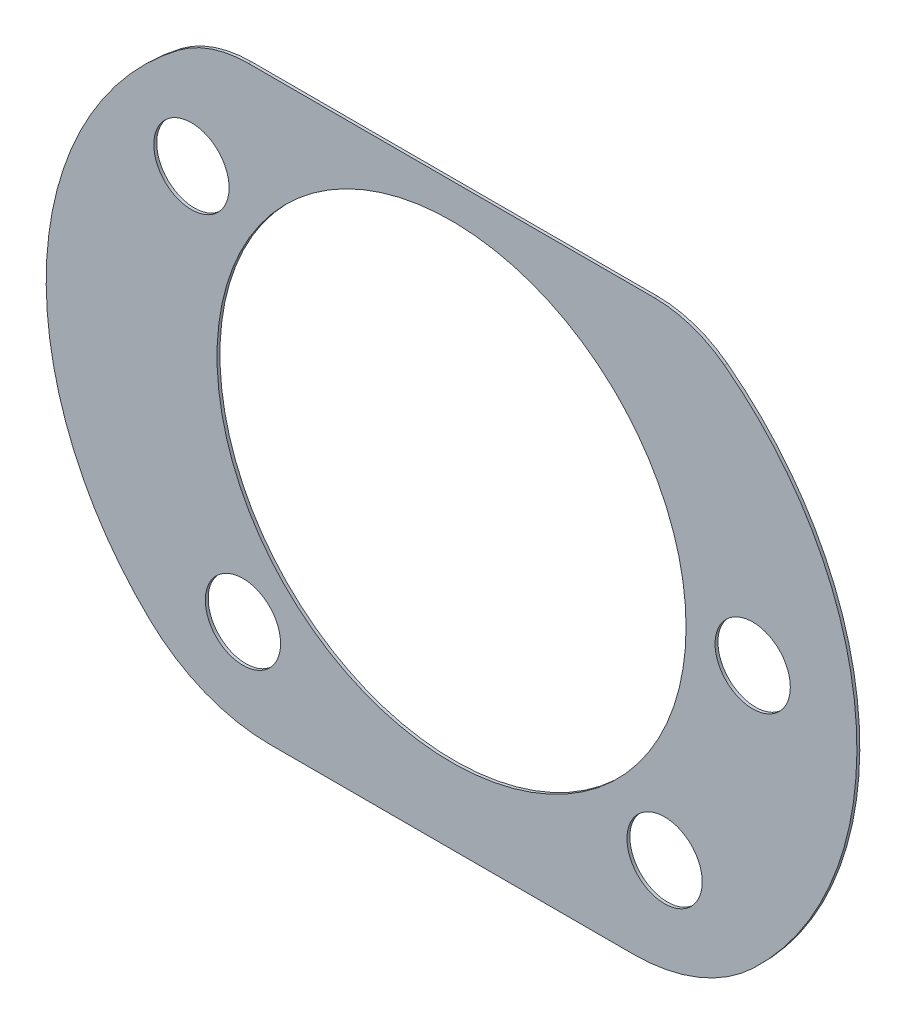
from build123d import *

# Parameters (mm, degrees)
SKETCH1_R      = 40.5
SKETCH1_R_2    = 6.5
EXTRUDE1_DEPTH = 0.5


with BuildPart() as part:
    # Sketch1 → Extrude1 (new body)
    with BuildSketch(Plane.XY):
        with BuildLine():
            Line((-31.419788217, -53.5000001), (31.419788217, -53.5000001))
            ThreePointArc((31.419788217, -53.5000001), (42.551411722, -51.358337419), (52.093689717, -45.239130643))
            ThreePointArc((52.093689717, -45.239130643), (69.907481155, -0.240172639), (47.122602539, 42.457446655))
            ThreePointArc((47.122602539, 42.457446655), (41.424181091, 45.462448781), (35.066073476, 46.4999999))
            Line((35.066073476, 46.4999999), (-35.066073476, 46.4999999))
            ThreePointArc((-35.066073476, 46.4999999), (-41.425769339, 45.462104521), (-47.125508858, 42.456122536))
            ThreePointArc((-47.125508858, 42.456122536), (-69.908118584, -0.241920052), (-52.093134412, -45.239658724))
            ThreePointArc((-52.093134412, -45.239658724), (-42.551055918, -51.358479588), (-31.419788217, -53.5000001))
        make_face()
        Circle(SKETCH1_R, mode=Mode.SUBTRACT)
        with Locations((-44.917257263, 26.2)):
            Circle(SKETCH1_R_2, mode=Mode.SUBTRACT)
        with Locations((-36.024297356, -37.5)):
            Circle(SKETCH1_R_2, mode=Mode.SUBTRACT)
        with Locations((36.789094852, -36.75)):
            Circle(SKETCH1_R_2, mode=Mode.SUBTRACT)
        with Locations((52, 0)):
            Circle(SKETCH1_R_2, mode=Mode.SUBTRACT)
    extrude(amount=EXTRUDE1_DEPTH)


solid = part.part
